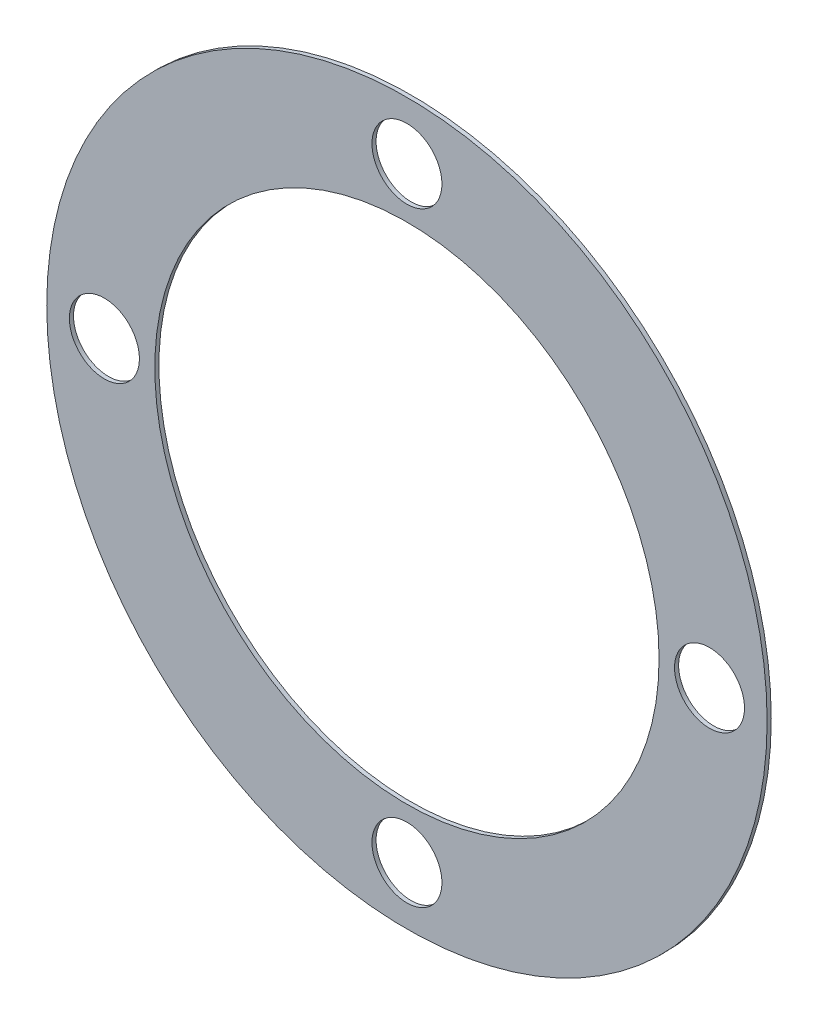
from build123d import *

# Parameters (mm, degrees)
SKETCH1_R           = 87.5
SKETCH1_R_2         = 8.5
SKETCH1_R_3         = 61.25
BOSS_EXTRUDE1_DEPTH = 1


with BuildPart() as part:
    # Sketch1 → Boss-Extrude1 (new body)
    with BuildSketch(Plane.XY):
        Circle(SKETCH1_R)
        with Locations((0, 73.5)):
            Circle(SKETCH1_R_2, mode=Mode.SUBTRACT)
        with Locations((73.5, 0)):
            Circle(SKETCH1_R_2, mode=Mode.SUBTRACT)
        with Locations(Location((-73.5, 0, 0), (0, 0, 180))):
            Circle(SKETCH1_R_2, mode=Mode.SUBTRACT)
        with Locations(Location((0, -73.5, 0), (0, 0, 180))):
            Circle(SKETCH1_R_2, mode=Mode.SUBTRACT)
        Circle(SKETCH1_R_3, mode=Mode.SUBTRACT)
    extrude(amount=BOSS_EXTRUDE1_DEPTH)


solid = part.part
